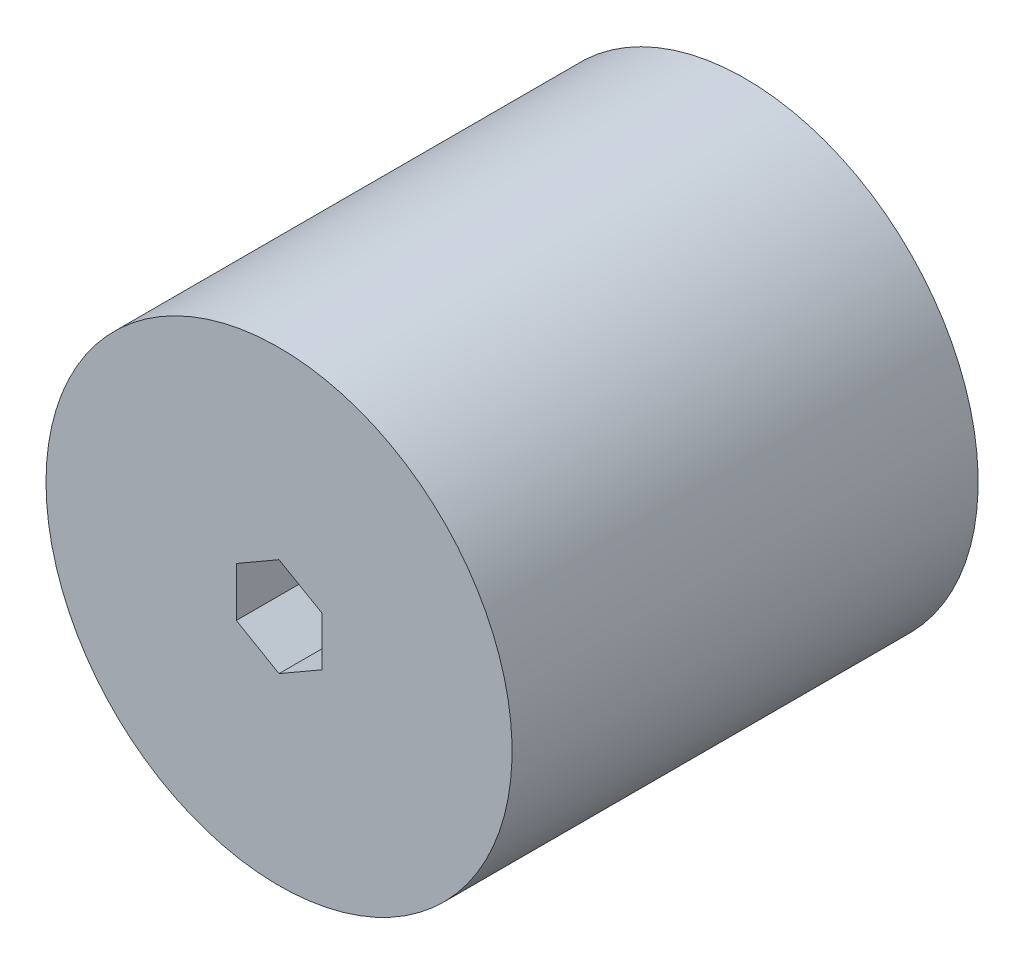
from build123d import *

# Parameters (mm, degrees)
SKETCH1_R           = 38.1
BOSS_EXTRUDE1_DEPTH = 76.2


with BuildPart() as part:
    # Sketch1 → Boss-Extrude1 (new body)
    with BuildSketch(Plane.XY):
        with Locations(Location((0, 0, 0), (0, 0, 180))):
            Circle(SKETCH1_R)
        Polygon((0, 8.065583261), (-6.985, 4.03279163), (-6.985, -4.03279163), (0, -8.065583261), (6.985, -4.03279163), (6.985, 4.03279163), align=None, mode=Mode.SUBTRACT)
    extrude(amount=BOSS_EXTRUDE1_DEPTH)


solid = part.part
